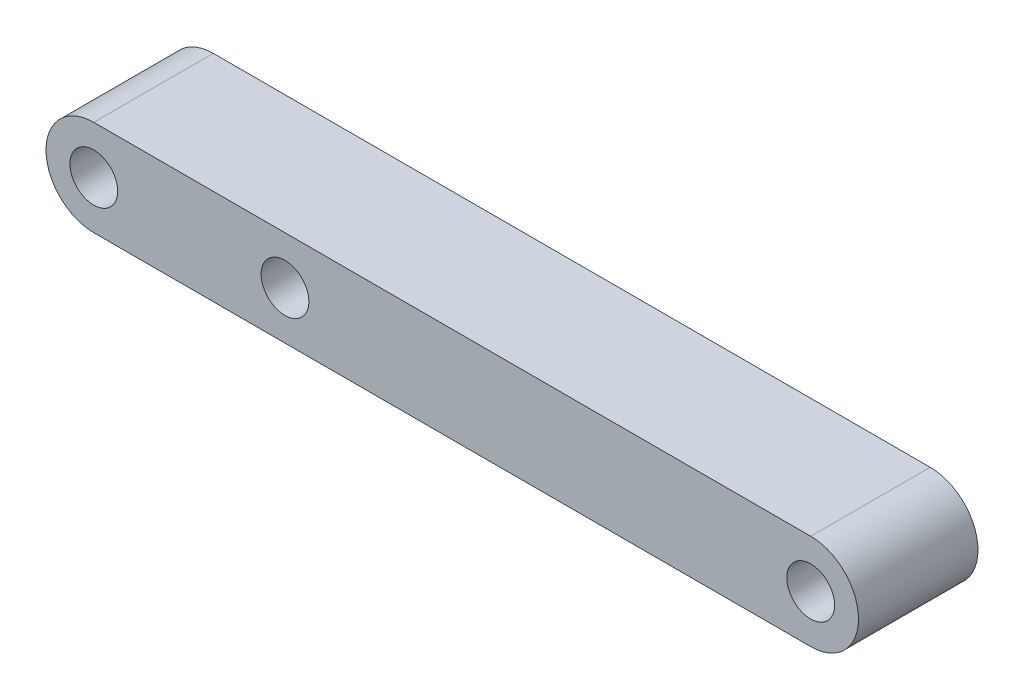
from build123d import *

# Parameters (mm, degrees)
ESQUISSE1_R        = 2
BOSS_EXTRU_1_DEPTH = 10


with BuildPart() as part:
    # Esquisse1 → Boss.-Extru.1 (new body)
    with BuildSketch(Plane.XY):
        with BuildLine():
            Line((0, 4), (60, 4))
            ThreePointArc((60, 4), (64, 0), (60, -4))
            Line((60, -4), (0, -4))
            ThreePointArc((0, -4), (-4, 0), (0, 4))
        make_face()
        Circle(ESQUISSE1_R, mode=Mode.SUBTRACT)
        with Locations((60, 0)):
            Circle(ESQUISSE1_R, mode=Mode.SUBTRACT)
        with Locations((16, 0)):
            Circle(ESQUISSE1_R, mode=Mode.SUBTRACT)
    extrude(amount=BOSS_EXTRU_1_DEPTH)


solid = part.part
